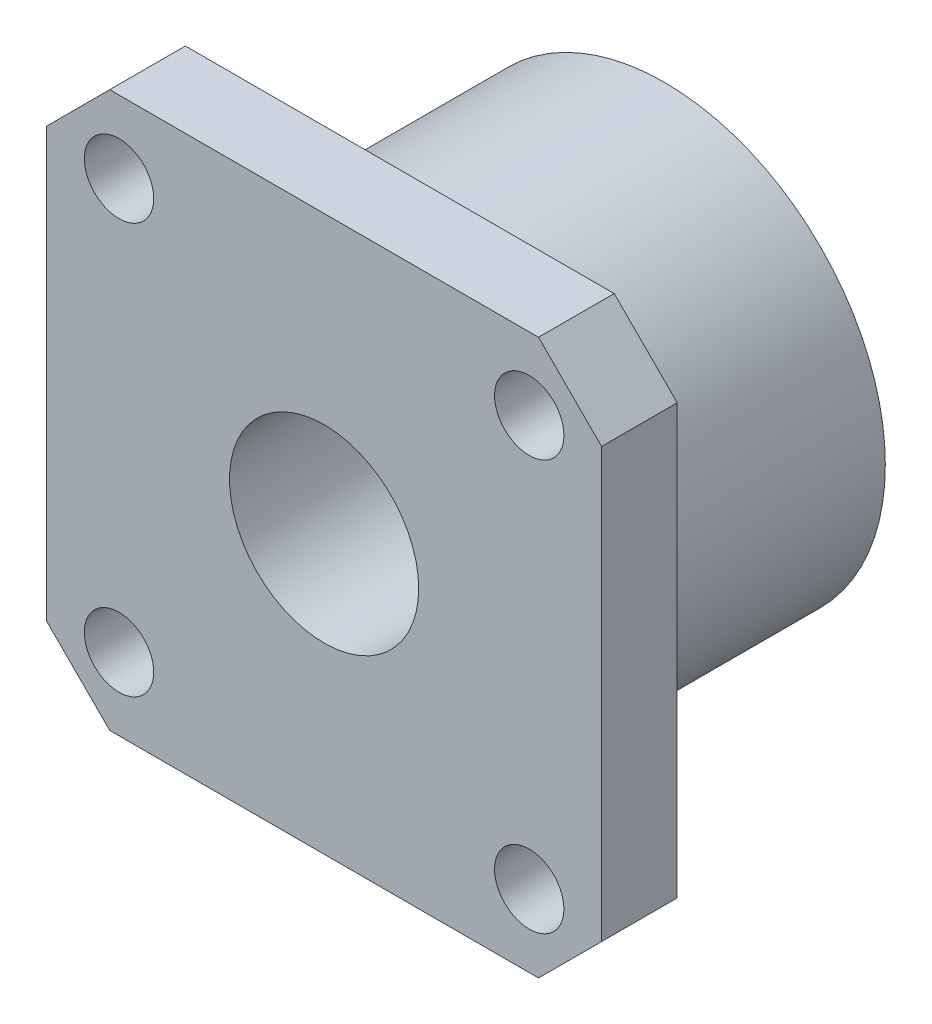
from build123d import *

# Parameters (mm, degrees)
SKETCH_1_W          = 44
SKETCH_1_H          = 44
SKETCH_1_R          = 2.75
EXTRUDE_1_DEPTH     = 6
CHAMFER_1_SIZE      = 5
SKETCH_2_R          = 17.5
SKETCH_2_R_2        = 7.5
EXTRUDE_2_DEPTH     = 21
SKETCH_3_R          = 7.5
CUT_EXTRUDE_1_DEPTH = 38.536648758


with BuildPart() as part:
    # 草图1 → 凸台-拉伸1 (new body)
    with BuildSketch(Plane.XY):
        Rectangle(SKETCH_1_W, SKETCH_1_H)
        with Locations((-16.263455967, 16.263455967)):
            Circle(SKETCH_1_R, mode=Mode.SUBTRACT)
        with Locations((16.263455967, 16.263455967)):
            Circle(SKETCH_1_R, mode=Mode.SUBTRACT)
        with Locations((16.263455967, -16.263455967)):
            Circle(SKETCH_1_R, mode=Mode.SUBTRACT)
        with Locations((-16.263455967, -16.263455967)):
            Circle(SKETCH_1_R, mode=Mode.SUBTRACT)
    extrude(amount=EXTRUDE_1_DEPTH)

    # 倒角1
    chamfer_1_edges = [part.edges().sort_by_distance(p)[0] for p in [
        (-22, 22, 3),
        (22, 22, 3),
        (22, -22, 3),
        (-22, -22, 3),
    ]]
    chamfer(chamfer_1_edges, length=CHAMFER_1_SIZE)

    # 草图2 → 凸台-拉伸2 (add)
    with BuildSketch(Plane(origin=(0, 0, 0), x_dir=(-1, 0, 0), z_dir=(0, 0, -1))):
        with Locations(Location((0, 0, 0), (0, 0, 180))):
            Circle(SKETCH_2_R)
        with Locations(Location((0, 0, 0), (0, 0, 180))):
            Circle(SKETCH_2_R_2, mode=Mode.SUBTRACT)
    extrude(amount=EXTRUDE_2_DEPTH)

    # 草图3 → 切除-拉伸1 (cut, through all)
    with BuildSketch(Plane(origin=(0, 0, 0), x_dir=(-1, 0, 0), z_dir=(0, 0, -1))):
        with Locations(Location((0, 0, 0), (0, 0, 180))):
            Circle(SKETCH_3_R)
    extrude(amount=-CUT_EXTRUDE_1_DEPTH, mode=Mode.SUBTRACT)


solid = part.part
